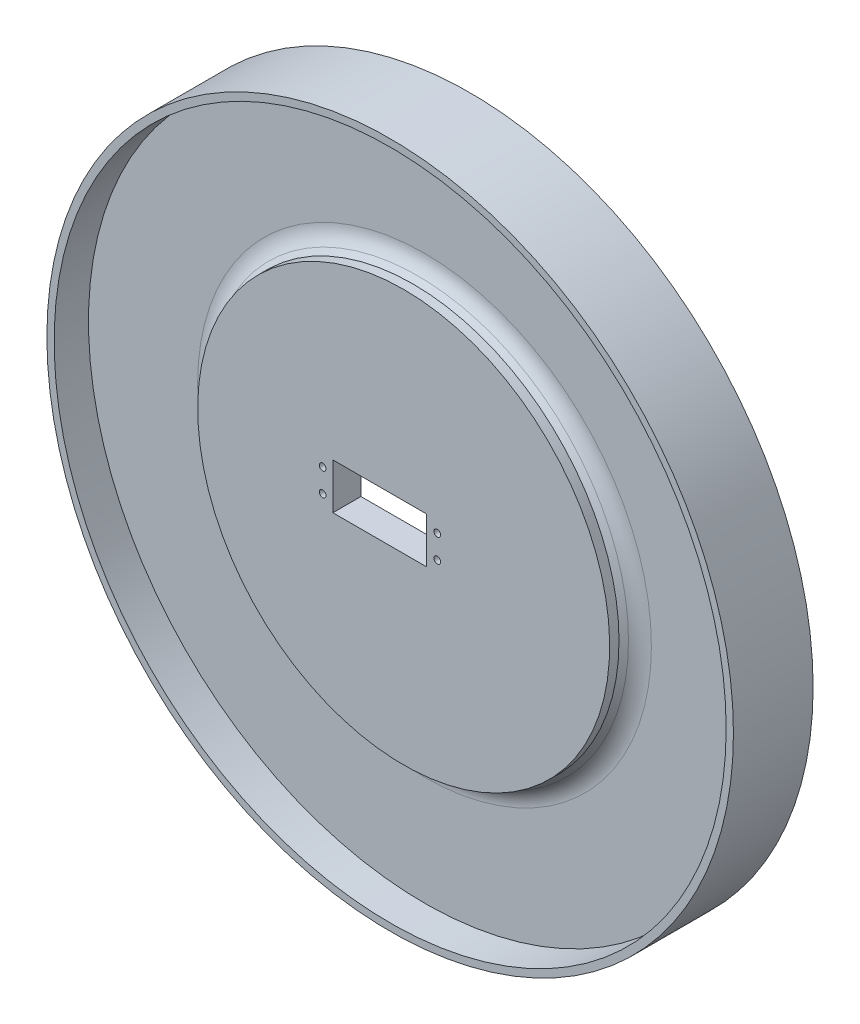
from build123d import *

# Parameters (mm, degrees)
SKETCH1_R               = 150
BOSS_EXTRUDE1_DEPTH     = 9.09
SKETCH2_R               = 146.82
CUT_EXTRUDE1_DEPTH      = 15
SKETCH5_R               = 90
BOSS_EXTRUDE2_DEPTH     = 15
CHAMFER1_SIZE           = 5
FILLET6_R               = 10
SKETCH6_R               = 1.55
CUT_EXTRUDE2_DEPTH      = 5
SKETCH7_R               = 16
CUT_EXTRUDE3_DEPTH      = 4.8
BOSS_EXTRUDE3_START     = 4.8
BOSS_EXTRUDE3_DEPTH     = 4.8
CIRPATTERN1_COUNT       = 30
SKETCH17_W              = 2.73
SKETCH17_H              = 90
SKETCH23_W              = 41
SKETCH23_H              = 20
CUT_EXTRUDE6_DEPTH      = 213.486594636
CUT_EXTRUDE7_DEPTH      = 213.486594636
CUT_EXTRUDE7_DEPTH_BACK = 213.486594636
SKETCH24_R              = 1.47
SKETCH26_R              = 150
SKETCH26_R_2            = 120
BOSS_EXTRUDE4_DEPTH     = 16.64


with BuildPart() as part:
    # Sketch1 → Boss-Extrude1 (new, symmetric)
    with BuildSketch(Plane.XY):
        Circle(SKETCH1_R)
    extrude(amount=BOSS_EXTRUDE1_DEPTH, both=True)

    # Sketch2 → Cut-Extrude1 (cut)
    with BuildSketch(Plane.XY.offset(9.09)):
        Circle(SKETCH2_R)
    extrude(amount=-CUT_EXTRUDE1_DEPTH, mode=Mode.SUBTRACT)

    # Sketch5 → Boss-Extrude2 (add)
    with BuildSketch(Plane.XY.offset(-5.91)):
        Circle(SKETCH5_R)
    extrude(amount=BOSS_EXTRUDE2_DEPTH)

    # Chamfer1
    chamfer1_edges = [part.edges().sort_by_distance(p)[0] for p in [
        (-90, 0, -5.91),
    ]]
    chamfer(chamfer1_edges, length=CHAMFER1_SIZE)

    # Fillet6
    fillet6_edges = [part.edges().sort_by_distance(p)[0] for p in [
        (-95, 0, -5.91),
    ]]
    fillet(fillet6_edges, radius=FILLET6_R)

    # Sketch6 → Cut-Extrude2 (cut)
    with BuildSketch(Plane.XY.offset(9.09)):
        with Locations((64.65, 0)):
            Circle(SKETCH6_R)
        with Locations((-68.33, 0)):
            Circle(SKETCH6_R)
        with Locations((-54.47, 24.14)):
            Circle(SKETCH6_R)
        with Locations((-54.47, -24.14)):
            Circle(SKETCH6_R)
        with Locations((50.79, -24.14)):
            Circle(SKETCH6_R)
        with Locations((50.79, 24.14)):
            Circle(SKETCH6_R)
    extrude(amount=-CUT_EXTRUDE2_DEPTH, mode=Mode.SUBTRACT)

    # Sketch7 → Cut-Extrude3 (cut)
    with BuildSketch(Plane.XY.offset(9.09)):
        Circle(SKETCH7_R)
    extrude(amount=-CUT_EXTRUDE3_DEPTH, mode=Mode.SUBTRACT)

    # Sketch8 → Boss-Extrude3 (add)
    with BuildSketch(Plane.XY.offset(4.29).offset(BOSS_EXTRUDE3_START)):
        with BuildLine():
            ThreePointArc((1.300521762, 15.947057507), (0.787845605, 15.007972717), (0.45011023, 13.992762443))
            ThreePointArc((0.45011023, 13.992762443), (0, 14), (-0.45011023, 13.992762443))
            ThreePointArc((-0.45011023, 13.992762443), (-0.787845605, 15.007972717), (-1.300521762, 15.947057507))
            ThreePointArc((-1.300521762, 15.947057507), (0, 16), (1.300521762, 15.947057507))
        make_face()
    boss_extrude3 = extrude(amount=-BOSS_EXTRUDE3_DEPTH)

    # CirPattern1: Boss-Extrude3 ×30 about axis
    cirpattern1_axis = Axis((0, 0, 0), (0, 0, 1))
    for i in range(1, CIRPATTERN1_COUNT):
        add(boss_extrude3.rotate(cirpattern1_axis, i * 360 / CIRPATTERN1_COUNT))

    # Sketch17 → Cut-Revolve4 (revolve, cut)
    with BuildSketch(Plane(origin=(0, 0, 0), x_dir=(0, 0, -1), z_dir=(1, 0, 0))):
        with Locations((-4.545, 45)):
            Rectangle(SKETCH17_W, SKETCH17_H)
    revolve(axis=Axis((0, 0, -0.91), (0, 0, 1)), mode=Mode.SUBTRACT)


with BuildPart() as cut_revolve4_piece_1:
    # of the separate pieces the step leaves, piece 1, a body of its own (cut_revolve4_pieces)
    add(part.part.solids().sort_by_distance((99.142135624, 0, -5.91))[0])

    # Sketch23 → Cut-Extrude6 (cut, through all)
    with BuildSketch(Plane.XY.offset(3.18)):
        with Locations((-10.44, 0)):
            Rectangle(SKETCH23_W, SKETCH23_H)
    extrude(amount=-CUT_EXTRUDE6_DEPTH, mode=Mode.SUBTRACT)

    # Sketch24 → Cut-Extrude7 (cut, two sides: drawn at the far end of the back side and taken through both)
    with BuildSketch(Plane.XY.offset(3.18).offset(-CUT_EXTRUDE7_DEPTH_BACK)):
        with Locations((-35.419501393, -5.08)):
            Circle(SKETCH24_R)
        with Locations((14.680498607, -5.08)):
            Circle(SKETCH24_R)
        with Locations((-35.419501393, 5.08)):
            Circle(SKETCH24_R)
        with Locations((14.680498607, 5.08)):
            Circle(SKETCH24_R)
    extrude(amount=CUT_EXTRUDE7_DEPTH + CUT_EXTRUDE7_DEPTH_BACK, mode=Mode.SUBTRACT)

    # Sketch26 → Boss-Extrude4 (add)
    with BuildSketch(Plane(origin=(0, 0, -9.09), x_dir=(-1, 0, 0), z_dir=(0, 0, -1))):
        Circle(SKETCH26_R)
        Circle(SKETCH26_R_2, mode=Mode.SUBTRACT)
    extrude(amount=BOSS_EXTRUDE4_DEPTH)


with BuildPart() as cut_revolve4_piece_2:
    # of the separate pieces the step leaves, piece 2, a body of its own (cut_revolve4_pieces)
    add(part.part.solids().sort_by_distance((90, 0, 5.91))[0])


solid = cut_revolve4_piece_1.part
